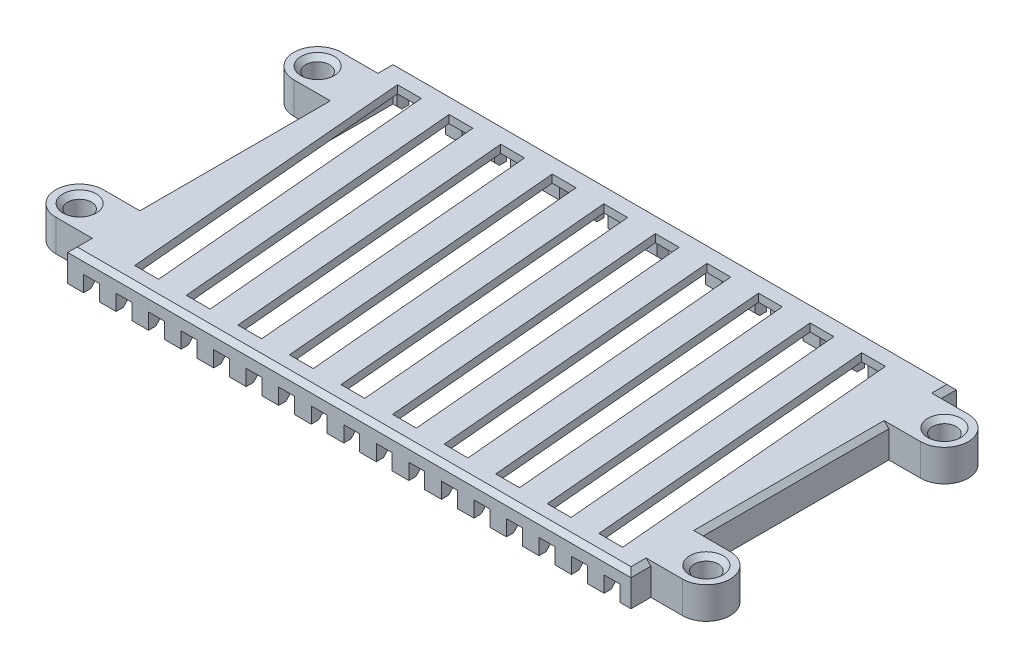
from build123d import *

# Parameters (mm, degrees)
SKETCH_1_R           = 1.5
EXTRUDE_1_DEPTH      = 15
CUT_EXTRUDE_START    = -11
CUT_EXTRUDE_1_DEPTH  = 11
SKETCH_3_W           = 90
SKETCH_3_H           = 57
CUT_EXTRUDE_2_DEPTH  = 12
SKETCH_4_R           = 2.8
EXTRUDE_2_DEPTH      = 3.3
EXTRUDE_2_2_DEPTH    = 3.3
EXTRUDE_2_3_DEPTH    = 3.3
EXTRUDE_2_4_DEPTH    = 3.3
SKETCH_5_R           = 1.5
EXTRUDE_3_DEPTH      = 1.3
EXTRUDE_3_2_DEPTH    = 1.3
EXTRUDE_3_3_DEPTH    = 1.3
EXTRUDE_3_4_DEPTH    = 1.3
SKETCH_6_W           = 95
SKETCH_6_H           = 62
CUT_EXTRUDE_3_DEPTH  = 5
SKETCH_9_W           = 9.5
SKETCH_9_H           = 2.5
CUT_EXTRUDE_4_DEPTH  = 5
CUT_EXTRUDE_5_DEPTH  = 73.996164283
FILLET_1_R           = 3
FILLET_3_R           = 1
SKETCH_12_R          = 2.5
EXTRUDE_5_DEPTH      = 3
SKETCH_13_R          = 1.5
CUT_EXTRUDE_6_DEPTH  = 73.003055491
CHAMFER_1_SIZE       = 1
SKETCH_15_W          = 82
SKETCH_15_H          = 4
SKETCH_15_W_2        = 2.5
SKETCH_15_H_2        = 20
CUT_EXTRUDE_8_DEPTH  = 73.439215899
SKETCH_16_R          = 3
SKETCH_16_R_2        = 1.5
SKETCH_16_W          = 71
SKETCH_16_H          = 41
SKETCH_16_W_2        = 68
SKETCH_16_H_2        = 38
EXTRUDE_6_DEPTH      = 4
SKETCH_17_W          = 68
SKETCH_17_H          = 38
EXTRUDE_7_DEPTH      = 1
SKETCH_19_W          = 127.115802746
SKETCH_19_H          = 106.325835006
CUT_EXTRUDE_9_DEPTH  = 73.996164283
CUT_EXTRUDE_10_DEPTH = 48.281074438
CHAMFER_2_SIZE       = 0.6
SKETCH_22_W          = 2
SKETCH_22_H          = 2
CUT_EXTRUDE_11_DEPTH = 60.188258971


with BuildPart() as part:
    # 草图1 → 凸台-拉伸1 (new body)
    with BuildSketch(Plane(origin=(0, 0, 0), x_dir=(1, 0, 0), z_dir=(0, 1, 0))):
        with BuildLine():
            Line((-47.5, 31), (-41.5, 31))
            Line((-41.5, 31), (-41.5, 41))
            ThreePointArc((-41.5, 41), (-35.5, 47), (-29.5, 41))
            Line((-29.5, 41), (-29.5, 31))
            Line((-29.5, 31), (-3, 31))
            Line((-3, 31), (-3, 33.8))
            ThreePointArc((-3, 33.8), (0, 36.8), (3, 33.8))
            Line((3, 33.8), (3, 31))
            Line((3, 31), (29.5, 31))
            Line((29.5, 31), (29.5, 41))
            ThreePointArc((29.5, 41), (35.5, 47), (41.5, 41))
            Line((41.5, 41), (41.5, 31))
            Line((41.5, 31), (47.5, 31))
            Line((47.5, 31), (50.8, 31))
            ThreePointArc((50.8, 31), (53.8, 28), (50.8, 25))
            Line((50.8, 25), (47.5, 25))
            Line((47.5, 25), (47.5, -25))
            Line((47.5, -25), (50.8, -25))
            ThreePointArc((50.8, -25), (53.8, -28), (50.8, -31))
            Line((50.8, -31), (47.5, -31))
            Line((47.5, -31), (41.5, -31))
            Line((41.5, -31), (41.5, -41))
            ThreePointArc((41.5, -41), (35.5, -47), (29.5, -41))
            Line((29.5, -41), (29.5, -31))
            Line((29.5, -31), (3, -31))
            Line((3, -31), (3, -33.8))
            ThreePointArc((3, -33.8), (0, -36.8), (-3, -33.8))
            Line((-3, -33.8), (-3, -31))
            Line((-3, -31), (-29.5, -31))
            Line((-29.5, -31), (-29.5, -41))
            ThreePointArc((-29.5, -41), (-35.5, -47), (-41.5, -41))
            Line((-41.5, -41), (-41.5, -31))
            Line((-41.5, -31), (-47.5, -31))
            Line((-47.5, -31), (-50.8, -31))
            ThreePointArc((-50.8, -31), (-53.8, -28), (-50.8, -25))
            Line((-50.8, -25), (-47.5, -25))
            Line((-47.5, -25), (-47.5, 25))
            Line((-47.5, 25), (-50.8, 25))
            ThreePointArc((-50.8, 25), (-53.8, 28), (-50.8, 31))
            Line((-50.8, 31), (-47.5, 31))
        make_face()
        with Locations(Location((-50.8, 28, 0), (0, 0, 270))):
            Circle(SKETCH_1_R, mode=Mode.SUBTRACT)
        with Locations(Location((50.8, 28, 0), (0, 0, 90))):
            Circle(SKETCH_1_R, mode=Mode.SUBTRACT)
        with Locations(Location((50.8, -28, 0), (0, 0, 270))):
            Circle(SKETCH_1_R, mode=Mode.SUBTRACT)
        with Locations(Location((-50.8, -28, 0), (0, 0, 90))):
            Circle(SKETCH_1_R, mode=Mode.SUBTRACT)
        with Locations(Location((0, 33.8, 0), (0, 0, 270))):
            Circle(SKETCH_1_R, mode=Mode.SUBTRACT)
        with Locations(Location((0, -33.8, 0), (0, 0, 90))):
            Circle(SKETCH_1_R, mode=Mode.SUBTRACT)
    extrude(amount=-EXTRUDE_1_DEPTH)

    # 草图2 → 切除-拉伸1 (cut)
    with BuildSketch(Plane.XZ.offset(15).offset(CUT_EXTRUDE_START)):
        with BuildLine():
            Line((-57.023911512, 31), (-3, 31))
            Line((-3, 31), (-3, 33.8))
            ThreePointArc((-3, 33.8), (0, 36.8), (3, 33.8))
            Line((3, 33.8), (3, 31))
            Line((3, 31), (57.023911512, 31))
            Line((57.023911512, 31), (57.023911512, 48.5806389))
            Line((57.023911512, 48.5806389), (-57.023911512, 48.5806389))
            Line((-57.023911512, 48.5806389), (-57.023911512, 31))
        make_face()
        with BuildLine():
            Line((3, -33.8), (3, -31))
            Line((3, -31), (57.023911512, -31))
            Line((57.023911512, -31), (57.023911512, -48.5806389))
            Line((57.023911512, -48.5806389), (-57.023911512, -48.5806389))
            Line((-57.023911512, -48.5806389), (-57.023911512, -31))
            Line((-57.023911512, -31), (-3, -31))
            Line((-3, -31), (-3, -33.8))
            ThreePointArc((-3, -33.8), (0, -36.8), (3, -33.8))
        make_face()
    extrude(amount=CUT_EXTRUDE_1_DEPTH, mode=Mode.SUBTRACT)

    # 草图3 → 切除-拉伸2 (cut)
    with BuildSketch(Plane.XZ.offset(15)):
        Rectangle(SKETCH_3_W, SKETCH_3_H)
    extrude(amount=-CUT_EXTRUDE_2_DEPTH, mode=Mode.SUBTRACT)

    # 草图6 → 切除-拉伸3 (cut)
    with BuildSketch(Plane.XZ.offset(15)):
        Rectangle(SKETCH_6_W, SKETCH_6_H)
    extrude(amount=-CUT_EXTRUDE_3_DEPTH, mode=Mode.SUBTRACT)

    # 草图9 → 切除-拉伸4 (cut)
    with BuildSketch(Plane.XZ.offset(10)):
        with Locations((36.75, 29.75)):
            Rectangle(SKETCH_9_W, SKETCH_9_H)
    extrude(amount=-CUT_EXTRUDE_4_DEPTH, mode=Mode.SUBTRACT)

    # 草图10 → 切除-拉伸5 (cut, through all)
    with BuildSketch(Plane(origin=(0, 0, 0), x_dir=(1, 0, 0), z_dir=(0, 1, 0))):
        with BuildLine():
            Line((-32, -19), (32, -19))
            ThreePointArc((32, -19), (33.414213562, -18.414213562), (34, -17))
            Line((34, -17), (34, 17))
            ThreePointArc((34, 17), (33.414213562, 18.414213562), (32, 19))
            Line((32, 19), (-32, 19))
            ThreePointArc((-32, 19), (-33.414213562, 18.414213562), (-34, 17))
            Line((-34, 17), (-34, -17))
            ThreePointArc((-34, -17), (-33.414213562, -18.414213562), (-32, -19))
        make_face()
    extrude(amount=-CUT_EXTRUDE_5_DEPTH, mode=Mode.SUBTRACT)

    # 圆角1
    fillet_1_edges = [part.edges().sort_by_distance(p)[0] for p in [
        (41.5, -2, -31),
        (29.5, -2, -31),
        (-29.5, -2, -31),
        (-41.5, -2, -31),
        (-41.5, -2, 31),
        (-29.5, -2, 31),
        (29.5, -2, 31),
        (41.5, -2, 31),
    ]]
    fillet(fillet_1_edges, radius=FILLET_1_R)

    # 圆角3
    fillet_3_edges = [part.edges().sort_by_distance(p)[0] for p in [
        (45, -3, 0),
        (0, -3, -28.5),
        (-45, -3, 0),
        (0, -3, 28.5),
        (0, -3, 19),
        (33.414213562, -3, 18.414213562),
        (34, -3, 0),
        (33.414213562, -3, -18.414213562),
        (0, -3, -19),
        (-33.414213562, -3, -18.414213562),
        (-34, -3, 0),
        (-33.414213562, -3, 18.414213562),
    ]]
    fillet(fillet_3_edges, radius=FILLET_3_R)


with BuildPart() as body_2:
    # 草图4 → 凸台-拉伸2 (new body)
    with BuildSketch(Plane.XZ.offset(4)):
        with Locations(Location((-35.5, 41, 0), (0, 0, 270))):
            Circle(SKETCH_4_R)
    extrude(amount=EXTRUDE_2_DEPTH)


with BuildPart() as body_3:
    # 草图4 → Extrude 2 2 (new body)
    with BuildSketch(Plane.XZ.offset(4)):
        with Locations(Location((35.5, 41, 0), (0, 0, 90))):
            Circle(SKETCH_4_R)
    extrude(amount=EXTRUDE_2_2_DEPTH)


with BuildPart() as body_4:
    # 草图4 → Extrude 2 3 (new body)
    with BuildSketch(Plane.XZ.offset(4)):
        with Locations(Location((35.5, -41, 0), (0, 0, 270))):
            Circle(SKETCH_4_R)
    extrude(amount=EXTRUDE_2_3_DEPTH)


with BuildPart() as body_5:
    # 草图4 → Extrude 2 4 (new body)
    with BuildSketch(Plane.XZ.offset(4)):
        with Locations(Location((-35.5, -41, 0), (0, 0, 90))):
            Circle(SKETCH_4_R)
    extrude(amount=EXTRUDE_2_4_DEPTH)


with BuildPart() as body_6:
    # 草图5 → 凸台-拉伸3 (new body)
    with BuildSketch(Plane.XZ.offset(7.3)):
        with Locations(Location((-35.5, 41, 0), (0, 0, 270))):
            Circle(SKETCH_5_R)
    extrude(amount=EXTRUDE_3_DEPTH)


with BuildPart() as body_7:
    # 草图5 → Extrude 3 2 (new body)
    with BuildSketch(Plane.XZ.offset(7.3)):
        with Locations(Location((35.5, 41, 0), (0, 0, 90))):
            Circle(SKETCH_5_R)
    extrude(amount=EXTRUDE_3_2_DEPTH)


with BuildPart() as body_8:
    # 草图5 → Extrude 3 3 (new body)
    with BuildSketch(Plane.XZ.offset(7.3)):
        with Locations(Location((35.5, -41, 0), (0, 0, 270))):
            Circle(SKETCH_5_R)
    extrude(amount=EXTRUDE_3_3_DEPTH)


with BuildPart() as body_9:
    # 草图5 → Extrude 3 4 (new body)
    with BuildSketch(Plane.XZ.offset(7.3)):
        with Locations(Location((-35.5, -41, 0), (0, 0, 90))):
            Circle(SKETCH_5_R)
    extrude(amount=EXTRUDE_3_4_DEPTH)


with BuildPart() as body_4_1:
    add(body_4.part)

    # Combine 1: union part, body 8, body 2, body 5, body 6, body 9, body 3, body 7
    add(part.part)
    add(body_8.part)
    add(body_2.part)
    add(body_5.part)
    add(body_6.part)
    add(body_9.part)
    add(body_3.part)
    add(body_7.part)

    # 草图12 → 凸台-拉伸5 (add)
    with BuildSketch(Plane.XZ.offset(3)):
        with Locations(Location((-39.5, 15, 0), (0, 0, 90))):
            Circle(SKETCH_12_R)
        with Locations(Location((-39.5, -15, 0), (0, 0, 90))):
            Circle(SKETCH_12_R)
        with Locations(Location((39.5, -15, 0), (0, 0, 90))):
            Circle(SKETCH_12_R)
        with Locations(Location((39.5, 15, 0), (0, 0, 90))):
            Circle(SKETCH_12_R)
    extrude(amount=EXTRUDE_5_DEPTH)

    # 草图13 → 切除-拉伸6 (cut, through all)
    with BuildSketch(Plane.XZ.offset(6)):
        with Locations(Location((39.5, -15, 0), (0, 0, 270))):
            Circle(SKETCH_13_R)
        with Locations(Location((39.5, 15, 0), (0, 0, 270))):
            Circle(SKETCH_13_R)
        with Locations(Location((-39.5, -15, 0), (0, 0, 270))):
            Circle(SKETCH_13_R)
        with Locations(Location((-39.5, 15, 0), (0, 0, 270))):
            Circle(SKETCH_13_R)
    extrude(amount=-CUT_EXTRUDE_6_DEPTH, mode=Mode.SUBTRACT)

    # 倒角1
    chamfer_1_edges = [body_4_1.edges().sort_by_distance(p)[0] for p in [
        (39.5, 0, 16.5),
        (-39.5, 0, -13.5),
        (-39.5, 0, 16.5),
        (39.5, 0, -13.5),
    ]]
    chamfer(chamfer_1_edges, length=CHAMFER_1_SIZE)

    # 草图15 → 切除-拉伸8 (cut, through all)
    with BuildSketch(Plane.XZ.offset(3)):
        with Locations((0, 23.5)):
            Rectangle(SKETCH_15_W, SKETCH_15_H)
        with Locations((0, -23.5)):
            Rectangle(SKETCH_15_W, SKETCH_15_H)
        with Locations((-39.5, 0)):
            Rectangle(SKETCH_15_W_2, SKETCH_15_H_2)
        with Locations((39.5, 0)):
            Rectangle(SKETCH_15_W_2, SKETCH_15_H_2)
    extrude(amount=-CUT_EXTRUDE_8_DEPTH, mode=Mode.SUBTRACT)

    # 草图19 → 切除-拉伸9 (cut, through all)
    with BuildSketch(Plane(origin=(0, 0, 0), x_dir=(1, 0, 0), z_dir=(0, 1, 0))):
        Rectangle(SKETCH_19_W, SKETCH_19_H)
    extrude(amount=-CUT_EXTRUDE_9_DEPTH, mode=Mode.SUBTRACT)


with BuildPart() as body_2_2:
    # 草图16 → 凸台-拉伸6 (new body)
    # profile 1 of 9: a face of its own
    with BuildSketch(Plane(origin=(0, 0, 0), x_dir=(1, 0, 0), z_dir=(0, 1, 0))):
        with Locations((-39.5, 15)):
            Circle(SKETCH_16_R)
        with Locations(Location((-39.5, 15, 0), (0, 0, 270))):
            Circle(SKETCH_16_R_2, mode=Mode.SUBTRACT)
    # profile 2 of 9: a face of its own
    with BuildSketch(Plane(origin=(0, 0, 0), x_dir=(1, 0, 0), z_dir=(0, 1, 0))):
        with Locations((-39.5, -15)):
            Circle(SKETCH_16_R)
        with Locations(Location((-39.5, -15, 0), (0, 0, 270))):
            Circle(SKETCH_16_R_2, mode=Mode.SUBTRACT)
    # profile 3 of 9: a face of its own
    with BuildSketch(Plane(origin=(0, 0, 0), x_dir=(1, 0, 0), z_dir=(0, 1, 0))):
        with Locations((39.5, -15)):
            Circle(SKETCH_16_R)
        with Locations(Location((39.5, -15, 0), (0, 0, 270))):
            Circle(SKETCH_16_R_2, mode=Mode.SUBTRACT)
    # profile 4 of 9: a face of its own
    with BuildSketch(Plane(origin=(0, 0, 0), x_dir=(1, 0, 0), z_dir=(0, 1, 0))):
        with Locations((39.5, 15)):
            Circle(SKETCH_16_R)
        with Locations(Location((39.5, 15, 0), (0, 0, 270))):
            Circle(SKETCH_16_R_2, mode=Mode.SUBTRACT)
    # profile 5 of 9: a face of its own
    with BuildSketch(Plane(origin=(0, 0, 0), x_dir=(1, 0, 0), z_dir=(0, 1, 0))):
        Rectangle(SKETCH_16_W, SKETCH_16_H)
        Rectangle(SKETCH_16_W_2, SKETCH_16_H_2, mode=Mode.SUBTRACT)
    # profile 6 of 9: a face of its own
    with BuildSketch(Plane(origin=(0, 0, 0), x_dir=(1, 0, 0), z_dir=(0, 1, 0))):
        with BuildLine():
            Line((-39.5, 12), (-35.5, 12))
            Line((-35.5, 12), (-35.5, 18))
            Line((-35.5, 18), (-39.5, 18))
            ThreePointArc((-39.5, 18), (-37.378679656, 17.121320344), (-36.5, 15))
            ThreePointArc((-36.5, 15), (-37.378679656, 12.878679656), (-39.5, 12))
        make_face()
    # profile 7 of 9: a face of its own
    with BuildSketch(Plane(origin=(0, 0, 0), x_dir=(1, 0, 0), z_dir=(0, 1, 0))):
        with BuildLine():
            Line((-39.5, -18), (-35.5, -18))
            Line((-35.5, -18), (-35.5, -12))
            Line((-35.5, -12), (-39.5, -12))
            ThreePointArc((-39.5, -12), (-37.378679656, -12.878679656), (-36.5, -15))
            ThreePointArc((-36.5, -15), (-37.378679656, -17.121320344), (-39.5, -18))
        make_face()
    # profile 8 of 9: a face of its own
    with BuildSketch(Plane(origin=(0, 0, 0), x_dir=(1, 0, 0), z_dir=(0, 1, 0))):
        with BuildLine():
            Line((35.5, 18), (35.5, 12))
            Line((35.5, 12), (39.5, 12))
            ThreePointArc((39.5, 12), (36.5, 15), (39.5, 18))
            Line((39.5, 18), (35.5, 18))
        make_face()
    # profile 9 of 9: a face of its own
    with BuildSketch(Plane(origin=(0, 0, 0), x_dir=(1, 0, 0), z_dir=(0, 1, 0))):
        with BuildLine():
            Line((35.5, -12), (35.5, -18))
            Line((35.5, -18), (39.5, -18))
            ThreePointArc((39.5, -18), (36.5, -15), (39.5, -12))
            Line((39.5, -12), (35.5, -12))
        make_face()
    extrude(amount=EXTRUDE_6_DEPTH)

    # 草图17 → 凸台-拉伸7 (add)
    with BuildSketch(Plane(origin=(0, 4, 0), x_dir=(1, 0, 0), z_dir=(0, 1, 0))):
        Rectangle(SKETCH_17_W, SKETCH_17_H)
    extrude(amount=-EXTRUDE_7_DEPTH)

    # 草图21 → 切除-拉伸10 (cut, through all)
    with BuildSketch(Plane.XZ.offset(-3)):
        Polygon((-32.427309301, -18), (-29.427309301, -18), (-26.251340096, 18.301494123), (-29.251340096, 18.301494123), align=None)
        Polygon((-25.927309301, -18), (-22.927309301, -18), (-19.751340096, 18.301494123), (-22.751340096, 18.301494123), align=None)
        Polygon((-19.427309301, -18), (-16.427309301, -18), (-13.251340096, 18.301494123), (-16.251340096, 18.301494123), align=None)
        Polygon((-12.927309301, -18), (-9.927309301, -18), (-6.751340096, 18.301494123), (-9.751340096, 18.301494123), align=None)
        Polygon((-6.427309301, -18), (-3.427309301, -18), (-0.251340096, 18.301494123), (-3.251340096, 18.301494123), align=None)
        Polygon((0.072690699, -18), (3.072690699, -18), (6.248659904, 18.301494123), (3.248659904, 18.301494123), align=None)
        Polygon((6.572690699, -18), (9.572690699, -18), (12.748659904, 18.301494123), (9.748659904, 18.301494123), align=None)
        Polygon((13.072690699, -18), (16.072690699, -18), (19.248659904, 18.301494123), (16.248659904, 18.301494123), align=None)
        Polygon((19.572690699, -18), (22.572690699, -18), (25.748659904, 18.301494123), (22.748659904, 18.301494123), align=None)
        Polygon((26.072690699, -18), (29.072690699, -18), (32.248659904, 18.301494123), (29.248659904, 18.301494123), align=None)
    extrude(amount=-CUT_EXTRUDE_10_DEPTH, mode=Mode.SUBTRACT)

    # 倒角2
    chamfer_2_edges = [body_2_2.edges().sort_by_distance(p)[0] for p in [
        (39.5, 4, 13.5),
        (39.5, 4, -16.5),
        (-39.5, 4, 13.5),
        (-39.5, 4, -16.5),
        (35.5, 4, 0),
        (0, 0, -19),
        (-34, 0, 0),
        (0, 0, 19),
        (34, 0, 0),
        (35.5, 4, -19.25),
        (0, 4, -20.5),
        (-35.5, 4, -19.25),
        (-35.5, 4, 0),
        (-35.5, 4, 19.25),
        (0, 4, 20.5),
        (35.5, 4, 19.25),
    ]]
    chamfer(chamfer_2_edges, length=CHAMFER_2_SIZE)

    # 草图22 → 切除-拉伸11 (cut, through all)
    with BuildSketch(Plane(origin=(0, 0, -20.5), x_dir=(-1, 0, 0), z_dir=(0, 0, -1))):
        with Locations((32.5, 1)):
            Rectangle(SKETCH_22_W, SKETCH_22_H)
        with Locations((28.4, 1)):
            Rectangle(SKETCH_22_W, SKETCH_22_H)
        with Locations((24.3, 1)):
            Rectangle(SKETCH_22_W, SKETCH_22_H)
        with Locations((20.2, 1)):
            Rectangle(SKETCH_22_W, SKETCH_22_H)
        with Locations((16.1, 1)):
            Rectangle(SKETCH_22_W, SKETCH_22_H)
        with Locations((12, 1)):
            Rectangle(SKETCH_22_W, SKETCH_22_H)
        with Locations((7.9, 1)):
            Rectangle(SKETCH_22_W, SKETCH_22_H)
        with Locations((3.8, 1)):
            Rectangle(SKETCH_22_W, SKETCH_22_H)
        with Locations((-0.3, 1)):
            Rectangle(SKETCH_22_W, SKETCH_22_H)
        with Locations((-4.4, 1)):
            Rectangle(SKETCH_22_W, SKETCH_22_H)
        with Locations((-8.5, 1)):
            Rectangle(SKETCH_22_W, SKETCH_22_H)
        with Locations((-12.6, 1)):
            Rectangle(SKETCH_22_W, SKETCH_22_H)
        with Locations((-16.7, 1)):
            Rectangle(SKETCH_22_W, SKETCH_22_H)
        with Locations((-20.8, 1)):
            Rectangle(SKETCH_22_W, SKETCH_22_H)
        with Locations((-24.9, 1)):
            Rectangle(SKETCH_22_W, SKETCH_22_H)
        with Locations((-29, 1)):
            Rectangle(SKETCH_22_W, SKETCH_22_H)
        with Locations((-33.1, 1)):
            Rectangle(SKETCH_22_W, SKETCH_22_H)
    extrude(amount=-CUT_EXTRUDE_11_DEPTH, mode=Mode.SUBTRACT)


solid = body_2_2.part
